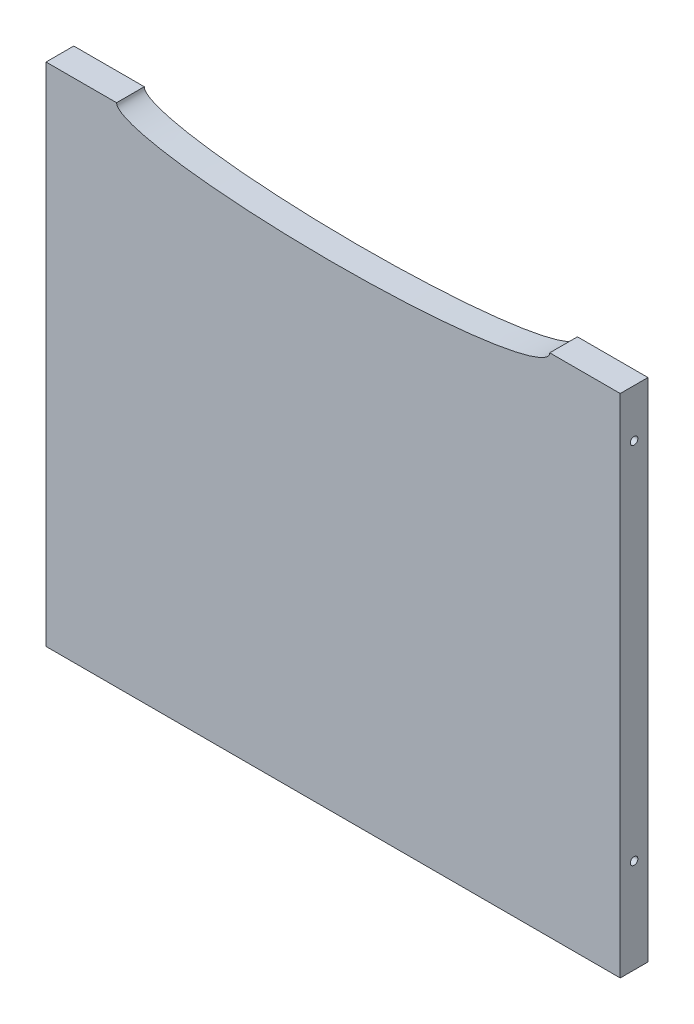
from build123d import *

# Parameters (mm, degrees)
BOSS_EXTRUDE1_DEPTH = 17.4625
RIGHTSCREWHOLES_R   = 2.38125
CUT_EXTRUDE1_DEPTH  = 50.8
CUT_EXTRUDE2_START  = -50.8
LEFTSCREWHOLES_R    = 2.38125
CUT_EXTRUDE2_DEPTH  = 50.8
BOTTOMSCREWHOLES_R  = 2.38125
CUT_EXTRUDE3_DEPTH  = 50.8


with BuildPart() as part:
    # PanelSketch → Boss-Extrude1 (new body)
    with BuildSketch(Plane.XY):
        with BuildLine():
            Line((-180.975, 159.54375), (-180.975, -159.54375))
            Line((-180.975, -159.54375), (180.975, -159.54375))
            Line((180.975, -159.54375), (180.975, 159.54375))
            Line((180.975, 159.54375), (136.525, 159.54375))
            add(Edge.make_bspline(
                [(-136.525, 159.54375), (-136.525, 140.49375), (0, 140.49375), (136.525, 140.49375), (136.525, 159.54375)],
                knots=[3.141592654, 3.141592654, 3.141592654, 4.71238898, 4.71238898, 6.283185307, 6.283185307, 6.283185307], degree=2, weights=[1, 0.707106781, 1, 0.707106781, 1]))
            Line((-136.525, 159.54375), (-180.975, 159.54375))
        make_face()
    extrude(amount=BOSS_EXTRUDE1_DEPTH)

    # RightScrewHoles → Cut-Extrude1 (cut)
    with BuildSketch(Plane(origin=(180.975, 0, 0), x_dir=(0, 0, -1), z_dir=(1, 0, 0))):
        with Locations((-8.73125, 129.38125)):
            Circle(RIGHTSCREWHOLES_R)
        with Locations((-8.73125, -100.0125)):
            Circle(RIGHTSCREWHOLES_R)
    extrude(amount=-CUT_EXTRUDE1_DEPTH, mode=Mode.SUBTRACT)

    # LeftScrewHoles → Cut-Extrude2 (cut)
    with BuildSketch(Plane.ZY.offset(180.975).offset(CUT_EXTRUDE2_START)):
        with Locations(Location((8.73125, 129.38125, 0), (0, 0, 180))):
            Circle(LEFTSCREWHOLES_R)
        with Locations(Location((8.73125, -100.0125, 0), (0, 0, 180))):
            Circle(LEFTSCREWHOLES_R)
    extrude(amount=CUT_EXTRUDE2_DEPTH, mode=Mode.SUBTRACT)

    # BottomScrewHoles → Cut-Extrude3 (cut)
    with BuildSketch(Plane.XZ.offset(159.54375)):
        with Locations(Location((-111.125, 8.73125, 0), (0, 0, 270))):
            Circle(BOTTOMSCREWHOLES_R)
        with Locations(Location((111.125, 8.73125, 0), (0, 0, 270))):
            Circle(BOTTOMSCREWHOLES_R)
    extrude(amount=-CUT_EXTRUDE3_DEPTH, mode=Mode.SUBTRACT)


solid = part.part
